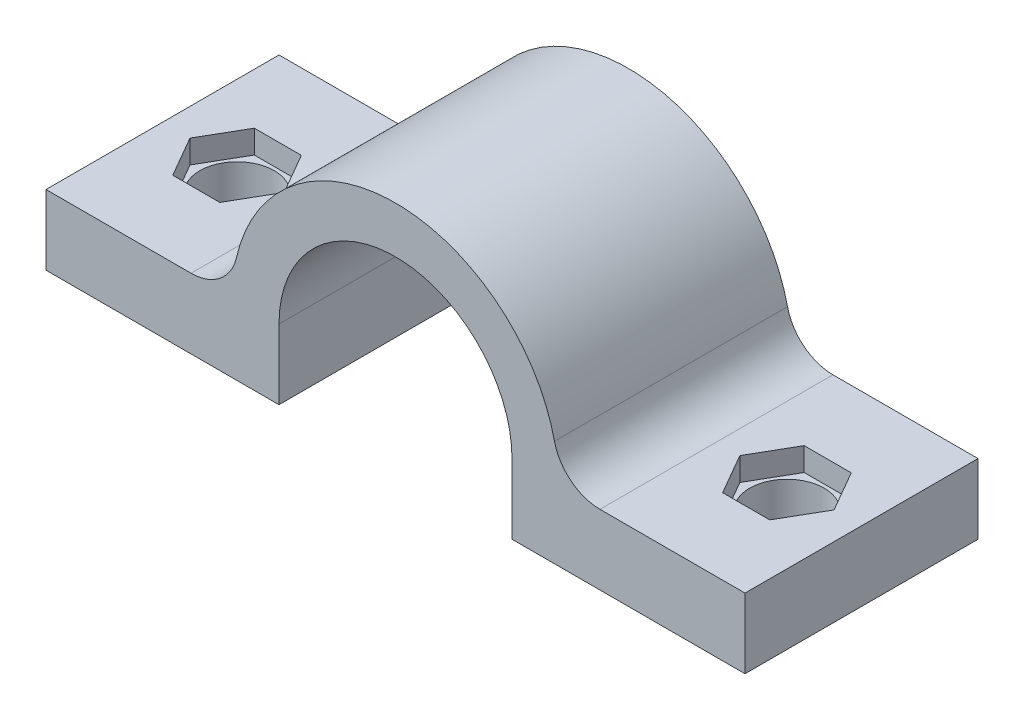
from build123d import *

# Parameters (mm, degrees)
SKETCH2_W           = 10
SKETCH2_H           = 3
BOSS_EXTRUDE1_DEPTH = 10
FILLET1_R           = 2
SKETCH3_R           = 1.6
CUT_EXTRUDE1_DEPTH  = 20.339079606
CUT_EXTRUDE2_DEPTH  = 1


with BuildPart() as part:
    # Sketch2 → Boss-Extrude1 (new body)
    with BuildSketch(Plane.XY):
        with Locations((-10, -1.5)):
            Rectangle(SKETCH2_W, SKETCH2_H)
        with BuildLine():
            Line((-7, 0), (-5, 0))
            ThreePointArc((-5, 0), (0, 5), (5, 0))
            Line((5, 0), (7, 0))
            ThreePointArc((7, 0), (0, 7), (-7, 0))
        make_face()
        with Locations((10, -1.5)):
            Rectangle(SKETCH2_W, SKETCH2_H)
    extrude(amount=BOSS_EXTRUDE1_DEPTH)

    # Fillet1
    fillet1_edges = [part.edges().sort_by_distance(p)[0] for p in [
        (-7, 0, 5),
        (7, 0, 5),
    ]]
    fillet(fillet1_edges, radius=FILLET1_R)

    # Sketch3 → Cut-Extrude1 (cut, through all)
    with BuildSketch(Plane(origin=(0, 0, 0), x_dir=(1, 0, 0), z_dir=(0, 1, 0))):
        with Locations(Location((11.8, -5, 0), (0, 0, 180))):
            Circle(SKETCH3_R)
        with Locations(Location((-11.8, -5, 0), (0, 0, 180))):
            Circle(SKETCH3_R)
    extrude(amount=-CUT_EXTRUDE1_DEPTH, mode=Mode.SUBTRACT)

    # Sketch4 → Cut-Extrude2 (cut)
    with BuildSketch(Plane(origin=(0, 0, 0), x_dir=(1, 0, 0), z_dir=(0, 1, 0))):
        Polygon((10.789637029, -6.75), (12.810362971, -6.75), (13.820725942, -5), (12.810362971, -3.25), (10.789637029, -3.25), (9.779274058, -5), align=None)
        Polygon((-12.810362971, -6.75), (-10.789637029, -6.75), (-9.779274058, -5), (-10.789637029, -3.25), (-12.810362971, -3.25), (-13.820725942, -5), align=None)
    extrude(amount=-CUT_EXTRUDE2_DEPTH, mode=Mode.SUBTRACT)


solid = part.part
